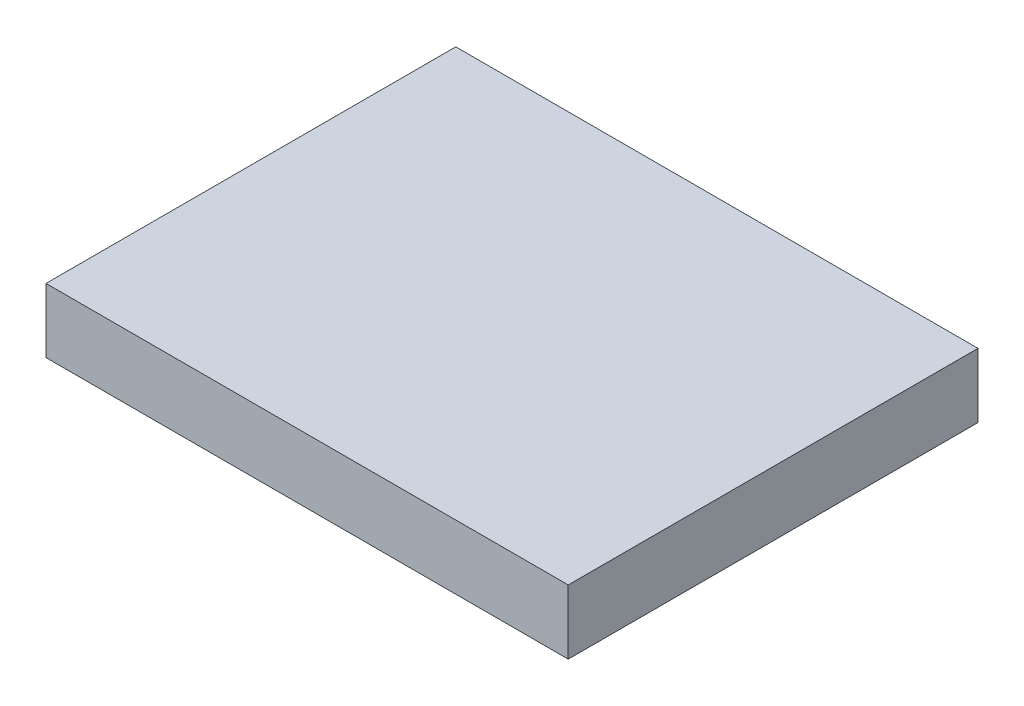
from build123d import *

# Parameters (mm, degrees)
SKETCH1_W           = 65
SKETCH1_H           = 51
BOSS_EXTRUDE1_DEPTH = 8


with BuildPart() as part:
    # Sketch1 → Boss-Extrude1 (new body)
    with BuildSketch(Plane(origin=(0, 0, 0), x_dir=(1, 0, 0), z_dir=(0, 1, 0))):
        with Locations((32.5, 25.5)):
            Rectangle(SKETCH1_W, SKETCH1_H)
    extrude(amount=BOSS_EXTRUDE1_DEPTH)


solid = part.part
